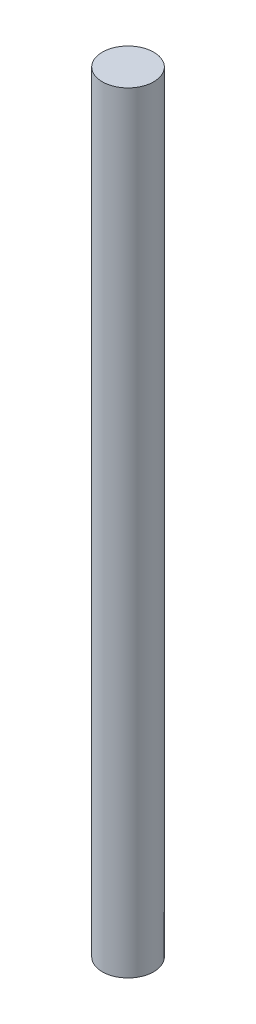
from build123d import *

# Parameters (mm, degrees)
SKETCH1_R           = 1.5
BOSS_EXTRUDE1_DEPTH = 45


with BuildPart() as part:
    # Sketch1 → Boss-Extrude1 (new body)
    with BuildSketch(Plane(origin=(0, 0, 0), x_dir=(1, 0, 0), z_dir=(0, 1, 0))):
        with Locations(Location((0, 0, 0), (0, 0, 90))):
            Circle(SKETCH1_R)
    extrude(amount=BOSS_EXTRUDE1_DEPTH)


solid = part.part
